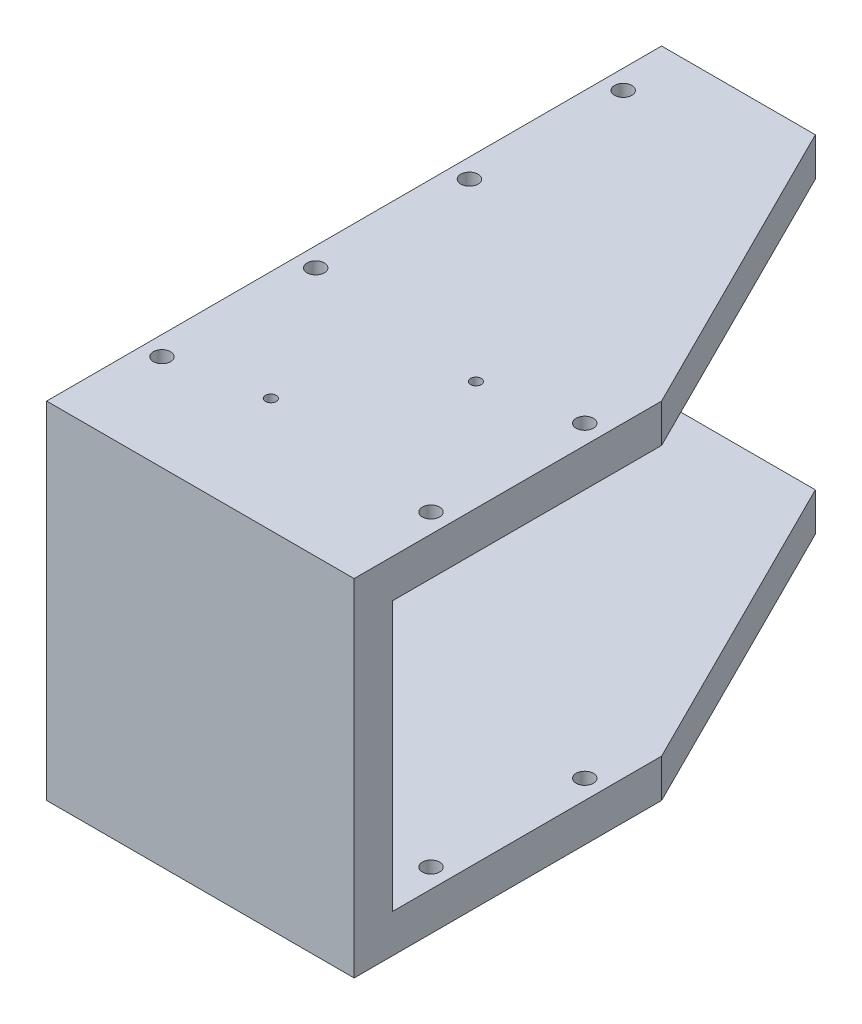
from build123d import *

# Parameters (mm, degrees)
SALIENTE_EXTRUIR1_DEPTH = 10
CROQUIS2_W              = 80
CROQUIS2_H              = 10
SALIENTE_EXTRUIR2_DEPTH = 70
SALIENTE_EXTRUIR3_DEPTH = 10
CROQUIS4_R              = 2.25
CORTAR_EXTRUIR1_DEPTH   = 201.249843945
CORTAR_EXTRUIR2_REACH   = 202.25
CROQUIS5_R              = 1.4


with BuildPart() as part:
    # Croquis1 → Saliente-Extruir1 (new body)
    with BuildSketch(Plane(origin=(0, 0, 0), x_dir=(1, 0, 0), z_dir=(0, 1, 0))):
        Polygon((0, 0), (0, 80), (-40, 160), (-80, 160), (-80, 0), align=None)
    extrude(amount=SALIENTE_EXTRUIR1_DEPTH)

    # Croquis2 → Saliente-Extruir2 (add)
    with BuildSketch(Plane(origin=(0, 10, 0), x_dir=(1, 0, 0), z_dir=(0, 1, 0))):
        with Locations((-40, 5)):
            Rectangle(CROQUIS2_W, CROQUIS2_H)
    extrude(amount=SALIENTE_EXTRUIR2_DEPTH)

    # Croquis3 → Saliente-Extruir3 (add)
    with BuildSketch(Plane(origin=(0, 80, 0), x_dir=(1, 0, 0), z_dir=(0, 1, 0))):
        Polygon((-80, 0), (0, 0), (0, 80), (-40, 160), (-80, 160), align=None)
    extrude(amount=SALIENTE_EXTRUIR3_DEPTH)

    # Croquis4 → Cortar-Extruir1 (cut, through all)
    with BuildSketch(Plane(origin=(0, 90, 0), x_dir=(1, 0, 0), z_dir=(0, 1, 0))):
        with Locations(Location((-75, 25, 0), (0, 0, 270))):
            Circle(CROQUIS4_R)
        with Locations(Location((-5, 25, 0), (0, 0, 270))):
            Circle(CROQUIS4_R)
        with Locations(Location((-5, 65, 0), (0, 0, 270))):
            Circle(CROQUIS4_R)
        with Locations(Location((-75, 65, 0), (0, 0, 270))):
            Circle(CROQUIS4_R)
        with Locations(Location((-75, 145, 0), (0, 0, 270))):
            Circle(CROQUIS4_R)
        with Locations(Location((-75, 105, 0), (0, 0, 270))):
            Circle(CROQUIS4_R)
    extrude(amount=-CORTAR_EXTRUIR1_DEPTH, mode=Mode.SUBTRACT)

    # Croquis5 → Cortar-Extruir2 (cut, up to next)
    with BuildSketch(Plane(origin=(0, 90, 0), x_dir=(1, 0, 0), z_dir=(0, 1, 0)), mode=Mode.PRIVATE) as cortar_extruir2_sk1:
        with Locations(Location((-51.43, 29.76, 0), (0, 0, 270))):
            Circle(CROQUIS5_R)
    cortar_extruir2_tool1 = extrude(cortar_extruir2_sk1.sketch, amount=-CORTAR_EXTRUIR2_REACH, mode=Mode.PRIVATE) & part.part
    # Croquis5 → Cortar-Extruir2 (cut, up to next)
    with BuildSketch(Plane(origin=(0, 90, 0), x_dir=(1, 0, 0), z_dir=(0, 1, 0)), mode=Mode.PRIVATE) as cortar_extruir2_sk2:
        with Locations(Location((-28.57, 60.24, 0), (0, 0, 270))):
            Circle(CROQUIS5_R)
    cortar_extruir2_tool2 = extrude(cortar_extruir2_sk2.sketch, amount=-CORTAR_EXTRUIR2_REACH, mode=Mode.PRIVATE) & part.part
    add(cortar_extruir2_tool1.solids().sort_by_distance((-51.43, 90, -29.76))[0], mode=Mode.SUBTRACT)
    add(cortar_extruir2_tool2.solids().sort_by_distance((-28.57, 90, -60.24))[0], mode=Mode.SUBTRACT)


solid = part.part
